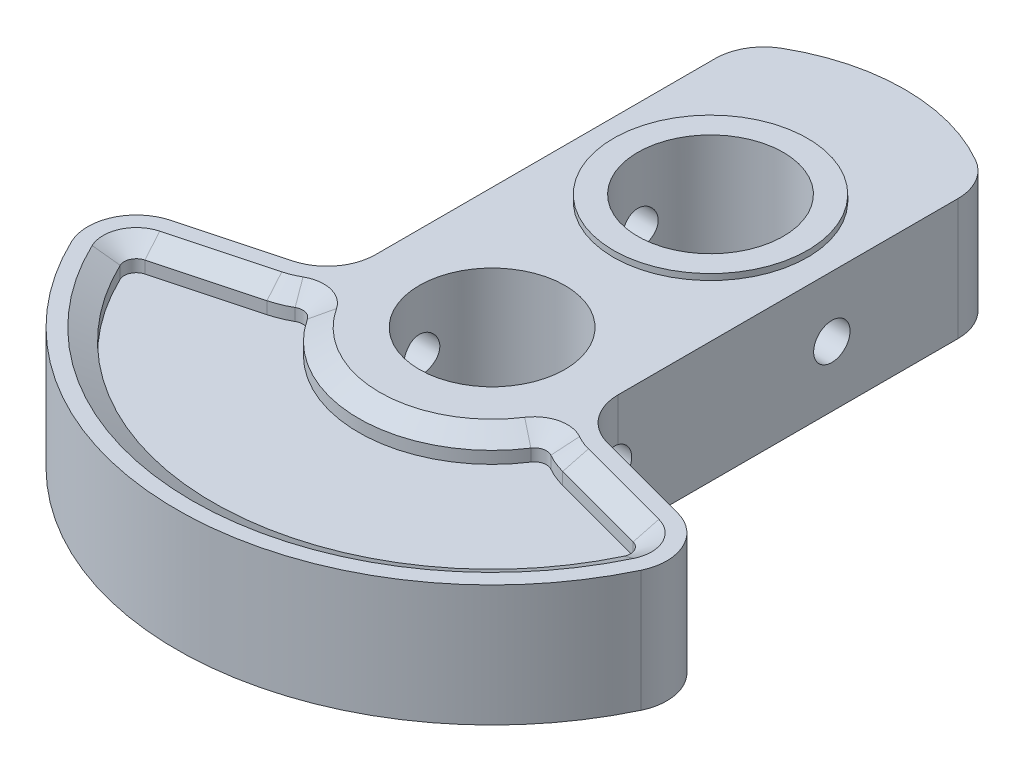
from build123d import *
from OCP.BRepFilletAPI import BRepFilletAPI_MakeChamfer

# Parameters (mm, degrees)
BOSS_EXTRUDE1_DEPTH     = 5
FILLET1_R               = 4
SKETCH2_R               = 8
BOSS_EXTRUDE2_DEPTH     = 0.5
SKETCH3_R               = 8
BOSS_EXTRUDE3_DEPTH     = 0.5
SKETCH4_R               = 8
BOSS_EXTRUDE4_DEPTH     = 0.5
CUT_EXTRUDE1_DEPTH      = 43.969085178
CUT_EXTRUDE1_DEPTH_BACK = 43.969085178
SKETCH5_R               = 6
CUT_EXTRUDE2_DEPTH      = 2
CHAMFER2_SIZE           = 1
CHAMFER2_SIZE2          = 1.732050808
CUT_EXTRUDE4_DEPTH      = 42.899788694
CUT_EXTRUDE4_DEPTH_BACK = 42.899788694
SKETCH9_R               = 1.5


with BuildPart() as part:
    # Sketch1 → Boss-Extrude1 (new, symmetric)
    with BuildSketch(Plane(origin=(0, 0, 0), x_dir=(1, 0, 0), z_dir=(0, 1, 0))):
        with BuildLine():
            Line((-10, 30.489995997), (-10, -2.679491924))
            Line((-10, -2.679491924), (-25.114071484, -6.729295173))
            ThreePointArc((-25.114071484, -6.729295173), (0, -26), (25.114071484, -6.729295173))
            Line((25.114071484, -6.729295173), (10, -2.679491924))
            Line((10, -2.679491924), (10, 30.489995997))
            ThreePointArc((10, 30.489995997), (0, 34), (-10, 30.489995997))
        make_face()
    extrude(amount=BOSS_EXTRUDE1_DEPTH, both=True)

    # Fillet1
    fillet1_edges = [part.edges().sort_by_distance(p)[0] for p in [
        (10, 0, -30.489995997),
        (10, 0, 2.679491924),
        (25.114071484, 0, 6.729295173),
        (-25.114071484, 0, 6.729295173),
        (-10, 0, 2.679491924),
        (-10, 0, -30.489995997),
    ]]
    fillet(fillet1_edges, radius=FILLET1_R)

    # Sketch2 → Boss-Extrude2 (add, symmetric)
    with BuildSketch(Plane(origin=(0, 0, 0), x_dir=(1, 0, 0), z_dir=(0, 1, 0))):
        with Locations((0, 18)):
            Circle(SKETCH2_R)
    extrude(amount=BOSS_EXTRUDE2_DEPTH, both=True)

    # Sketch3 → Boss-Extrude3 (add, symmetric)
    with BuildSketch(Plane(origin=(0, 5, 0), x_dir=(1, 0, 0), z_dir=(0, 1, 0))):
        with Locations(Location((0, 18, 0), (0, 0, 270))):
            Circle(SKETCH3_R)
    extrude(amount=BOSS_EXTRUDE3_DEPTH, both=True)

    # Sketch4 → Boss-Extrude4 (add, symmetric)
    with BuildSketch(Plane.XZ.offset(5)):
        with Locations(Location((0, 0, 0), (0, 0, 90))):
            Circle(SKETCH4_R)
    extrude(amount=BOSS_EXTRUDE4_DEPTH, both=True)

    # Sketch5 → Cut-Extrude1 (cut, two sides: drawn at the far end of the back side and taken through both)
    with BuildSketch(Plane(origin=(0, -5.5, 0), x_dir=(-1, 0, 0), z_dir=(0, -1, 0)).offset(-CUT_EXTRUDE1_DEPTH_BACK)):
        with Locations(Location((0, 0, 0), (0, 0, 90))):
            Circle(SKETCH5_R)
        with Locations(Location((0, 18, 0), (0, 0, 90))):
            Circle(SKETCH5_R)
    extrude(amount=CUT_EXTRUDE1_DEPTH + CUT_EXTRUDE1_DEPTH_BACK, mode=Mode.SUBTRACT)

    # Sketch6 → Cut-Extrude2 (cut)
    with BuildSketch(Plane(origin=(0, 5, 0), x_dir=(1, 0, 0), z_dir=(0, 1, 0))):
        with BuildLine():
            Line((12.188266684, -6.371664756), (20.119713435, -8.496889508))
            ThreePointArc((20.119713435, -8.496889508), (20.768948696, -9.043962883), (20.763662316, -9.892943304))
            ThreePointArc((20.763662316, -9.892943304), (0, -23), (-20.763662316, -9.892943304))
            ThreePointArc((-20.763662316, -9.892943304), (-20.768948696, -9.043962883), (-20.119713435, -8.496889508))
            Line((-20.119713435, -8.496889508), (-12.188266684, -6.371664756))
            ThreePointArc((-12.188266684, -6.371664756), (-11.342355786, -6.086056673), (-10.539679728, -5.695098402))
            ThreePointArc((-10.539679728, -5.695098402), (-9.810114884, -5.592432974), (-9.208235905, -6.017340901))
            ThreePointArc((-9.208235905, -6.017340901), (0, -11), (9.208235905, -6.017340901))
            ThreePointArc((9.208235905, -6.017340901), (9.810114884, -5.592432974), (10.539679728, -5.695098402))
            ThreePointArc((10.539679728, -5.695098402), (11.342355786, -6.086056673), (12.188266684, -6.371664756))
        make_face()
    cut_extrude2 = extrude(amount=-CUT_EXTRUDE2_DEPTH, mode=Mode.SUBTRACT)

    # Mirror7: Cut-Extrude2 across plane
    add(cut_extrude2.mirror(Plane.ZX), mode=Mode.SUBTRACT)

    # Chamfer2: one chamfer whose edges measure the first distance from different faces: ONE call of the kernel's chamfer builder (chamfer() names one face for all edges)
    chamfer2_edges_1 = [part.edges().sort_by_distance(p)[0] for p in [
        (9.810114884, -5, 5.592432974),
        (0, -5, 11),
        (-9.810114884, -5, 5.592432974),
        (-11.342355786, -5, 6.086056673),
        (-16.153990059, -5, 7.434277132),
        (-20.768948696, -5, 9.043962883),
        (0, -5, 23),
        (20.768948696, -5, 9.043962883),
        (16.153990059, -5, 7.434277132),
        (11.342355786, -5, 6.086056673),
    ]]
    chamfer2_side_1 = [part.faces().sort_by_distance(p)[0] for p in [
        (-9.233359985, -5, -14.391060437),
    ]]
    chamfer2_edges_2 = [part.edges().sort_by_distance(p)[0] for p in [
        (9.810114884, 5, 5.592432974),
    ]]
    chamfer2_side_2 = [part.faces().sort_by_distance(p)[0] for p in [
        (9.810114884, 4, 5.592432974),
    ]]
    chamfer2_edges_3 = [part.edges().sort_by_distance(p)[0] for p in [
        (0, 5, 11),
    ]]
    chamfer2_side_3 = [part.faces().sort_by_distance(p)[0] for p in [
        (0, 4, 11),
    ]]
    chamfer2_edges_4 = [part.edges().sort_by_distance(p)[0] for p in [
        (-9.810114884, 5, 5.592432974),
    ]]
    chamfer2_side_4 = [part.faces().sort_by_distance(p)[0] for p in [
        (-9.810114884, 4, 5.592432974),
    ]]
    chamfer2_edges_5 = [part.edges().sort_by_distance(p)[0] for p in [
        (-11.342355786, 5, 6.086056673),
    ]]
    chamfer2_side_5 = [part.faces().sort_by_distance(p)[0] for p in [
        (-11.342355786, 4, 6.086056673),
    ]]
    chamfer2_edges_6 = [part.edges().sort_by_distance(p)[0] for p in [
        (-16.153990059, 5, 7.434277132),
    ]]
    chamfer2_side_6 = [part.faces().sort_by_distance(p)[0] for p in [
        (-16.153990059, 4, 7.434277132),
    ]]
    chamfer2_edges_7 = [part.edges().sort_by_distance(p)[0] for p in [
        (-20.768948696, 5, 9.043962883),
    ]]
    chamfer2_side_7 = [part.faces().sort_by_distance(p)[0] for p in [
        (-20.768948696, 4, 9.043962883),
    ]]
    chamfer2_edges_8 = [part.edges().sort_by_distance(p)[0] for p in [
        (0, 5, 23),
    ]]
    chamfer2_side_8 = [part.faces().sort_by_distance(p)[0] for p in [
        (0, 4, 23),
    ]]
    chamfer2_edges_9 = [part.edges().sort_by_distance(p)[0] for p in [
        (20.768948696, 5, 9.043962883),
    ]]
    chamfer2_side_9 = [part.faces().sort_by_distance(p)[0] for p in [
        (20.768948696, 4, 9.043962883),
    ]]
    chamfer2_edges_10 = [part.edges().sort_by_distance(p)[0] for p in [
        (16.153990059, 5, 7.434277132),
    ]]
    chamfer2_side_10 = [part.faces().sort_by_distance(p)[0] for p in [
        (16.153990059, 4, 7.434277132),
    ]]
    chamfer2_edges_11 = [part.edges().sort_by_distance(p)[0] for p in [
        (11.342355786, 5, 6.086056673),
    ]]
    chamfer2_side_11 = [part.faces().sort_by_distance(p)[0] for p in [
        (11.342355786, 4, 6.086056673),
    ]]
    chamfer2 = BRepFilletAPI_MakeChamfer(part.part.solid().wrapped)
    for e in chamfer2_edges_1:
        chamfer2.Add(CHAMFER2_SIZE, CHAMFER2_SIZE2, e.wrapped, chamfer2_side_1[0].wrapped)  # the first distance lies on this face
    for e in chamfer2_edges_2:
        chamfer2.Add(CHAMFER2_SIZE, CHAMFER2_SIZE2, e.wrapped, chamfer2_side_2[0].wrapped)  # the first distance lies on this face
    for e in chamfer2_edges_3:
        chamfer2.Add(CHAMFER2_SIZE, CHAMFER2_SIZE2, e.wrapped, chamfer2_side_3[0].wrapped)  # the first distance lies on this face
    for e in chamfer2_edges_4:
        chamfer2.Add(CHAMFER2_SIZE, CHAMFER2_SIZE2, e.wrapped, chamfer2_side_4[0].wrapped)  # the first distance lies on this face
    for e in chamfer2_edges_5:
        chamfer2.Add(CHAMFER2_SIZE, CHAMFER2_SIZE2, e.wrapped, chamfer2_side_5[0].wrapped)  # the first distance lies on this face
    for e in chamfer2_edges_6:
        chamfer2.Add(CHAMFER2_SIZE, CHAMFER2_SIZE2, e.wrapped, chamfer2_side_6[0].wrapped)  # the first distance lies on this face
    for e in chamfer2_edges_7:
        chamfer2.Add(CHAMFER2_SIZE, CHAMFER2_SIZE2, e.wrapped, chamfer2_side_7[0].wrapped)  # the first distance lies on this face
    for e in chamfer2_edges_8:
        chamfer2.Add(CHAMFER2_SIZE, CHAMFER2_SIZE2, e.wrapped, chamfer2_side_8[0].wrapped)  # the first distance lies on this face
    for e in chamfer2_edges_9:
        chamfer2.Add(CHAMFER2_SIZE, CHAMFER2_SIZE2, e.wrapped, chamfer2_side_9[0].wrapped)  # the first distance lies on this face
    for e in chamfer2_edges_10:
        chamfer2.Add(CHAMFER2_SIZE, CHAMFER2_SIZE2, e.wrapped, chamfer2_side_10[0].wrapped)  # the first distance lies on this face
    for e in chamfer2_edges_11:
        chamfer2.Add(CHAMFER2_SIZE, CHAMFER2_SIZE2, e.wrapped, chamfer2_side_11[0].wrapped)  # the first distance lies on this face
    add(Compound.cast(chamfer2.Shape()), mode=Mode.REPLACE)

    # Sketch9 → Cut-Extrude4 (cut, two sides: drawn at the far end of the back side and taken through both)
    with BuildSketch(Plane(origin=(0, 0, 0), x_dir=(0, 0, -1), z_dir=(1, 0, 0)).offset(-CUT_EXTRUDE4_DEPTH_BACK)):
        Circle(SKETCH9_R)
        with Locations((18, 0)):
            Circle(SKETCH9_R)
    extrude(amount=CUT_EXTRUDE4_DEPTH + CUT_EXTRUDE4_DEPTH_BACK, mode=Mode.SUBTRACT)


solid = part.part
